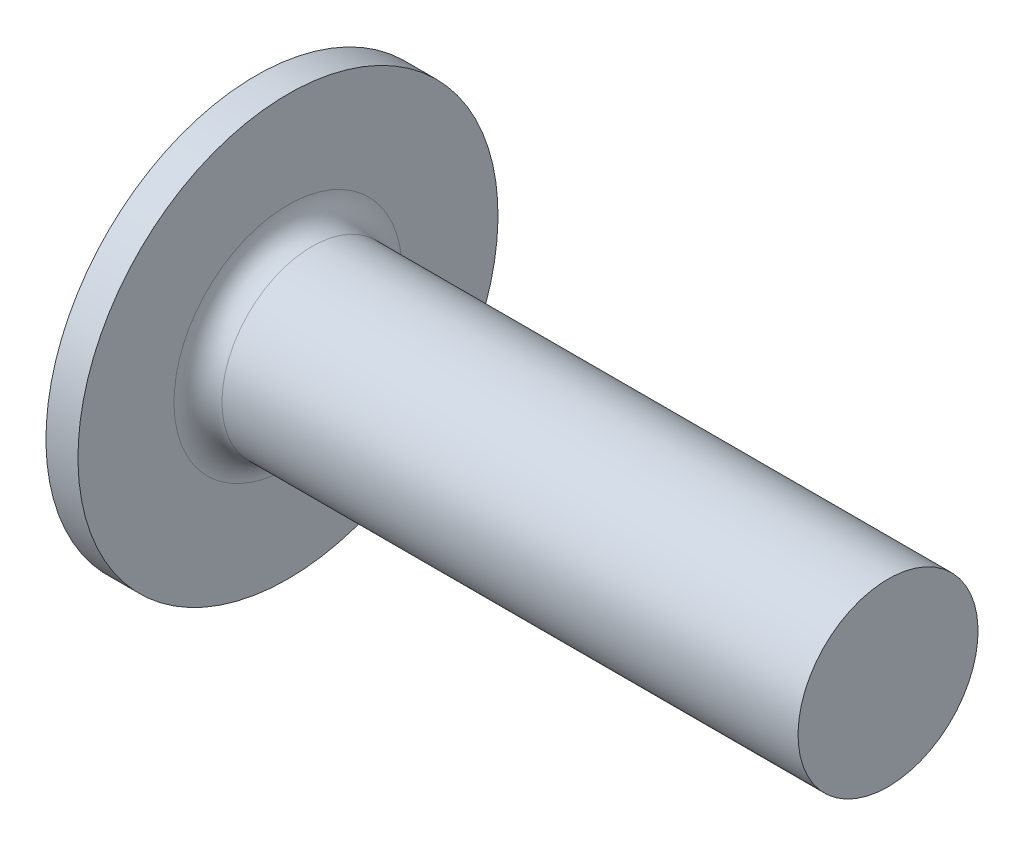
from build123d import *

# Parameters (mm, degrees)
CUT_EXTRUDE1_DEPTH = 0.75
FILLET1_R          = 0.4


with BuildPart() as part:
    # Sketch1 → Revolve1 (revolve)
    with BuildSketch(Plane.XY):
        Polygon((0, 1.5), (10, 1.5), (10, 0), (-0.8, 0), (-0.8, 3.038119785), (-0.533333333, 3.5), (0, 3.5), align=None)
    revolve(axis=Axis((-0.8, 0, 0), (1, 0, 0)))

    # Sketch2 → Cut-Extrude1 (cut)
    with BuildSketch(Plane(origin=(-0.8, 0, 0), x_dir=(0, 0, -1), z_dir=(1, 0, 0))):
        with BuildLine():
            ThreePointArc((0.16930818, 0.744268952), (0, 0.875), (-0.16930818, 0.744268952))
            ThreePointArc((-0.16930818, 0.744268952), (-0.3175, 0.549926131), (-0.55990173, 0.518759661))
            ThreePointArc((-0.55990173, 0.518759661), (-0.757772228, 0.4375), (-0.72920991, 0.225509291))
            ThreePointArc((-0.72920991, 0.225509291), (-0.635, 0), (-0.72920991, -0.225509291))
            ThreePointArc((-0.72920991, -0.225509291), (-0.757772228, -0.4375), (-0.55990173, -0.518759661))
            ThreePointArc((-0.55990173, -0.518759661), (-0.3175, -0.549926131), (-0.16930818, -0.744268952))
            ThreePointArc((-0.16930818, -0.744268952), (0, -0.875), (0.16930818, -0.744268952))
            ThreePointArc((0.16930818, -0.744268952), (0.3175, -0.549926131), (0.55990173, -0.518759661))
            ThreePointArc((0.55990173, -0.518759661), (0.757772228, -0.4375), (0.72920991, -0.225509291))
            ThreePointArc((0.72920991, -0.225509291), (0.635, 0), (0.72920991, 0.225509291))
            ThreePointArc((0.72920991, 0.225509291), (0.757772228, 0.4375), (0.55990173, 0.518759661))
            ThreePointArc((0.55990173, 0.518759661), (0.3175, 0.549926131), (0.16930818, 0.744268952))
        make_face()
    extrude(amount=CUT_EXTRUDE1_DEPTH, mode=Mode.SUBTRACT)

    # Fillet1
    fillet1_edges = [part.edges().sort_by_distance(p)[0] for p in [
        (0, -1.5, 0),
    ]]
    fillet(fillet1_edges, radius=FILLET1_R)


solid = part.part
